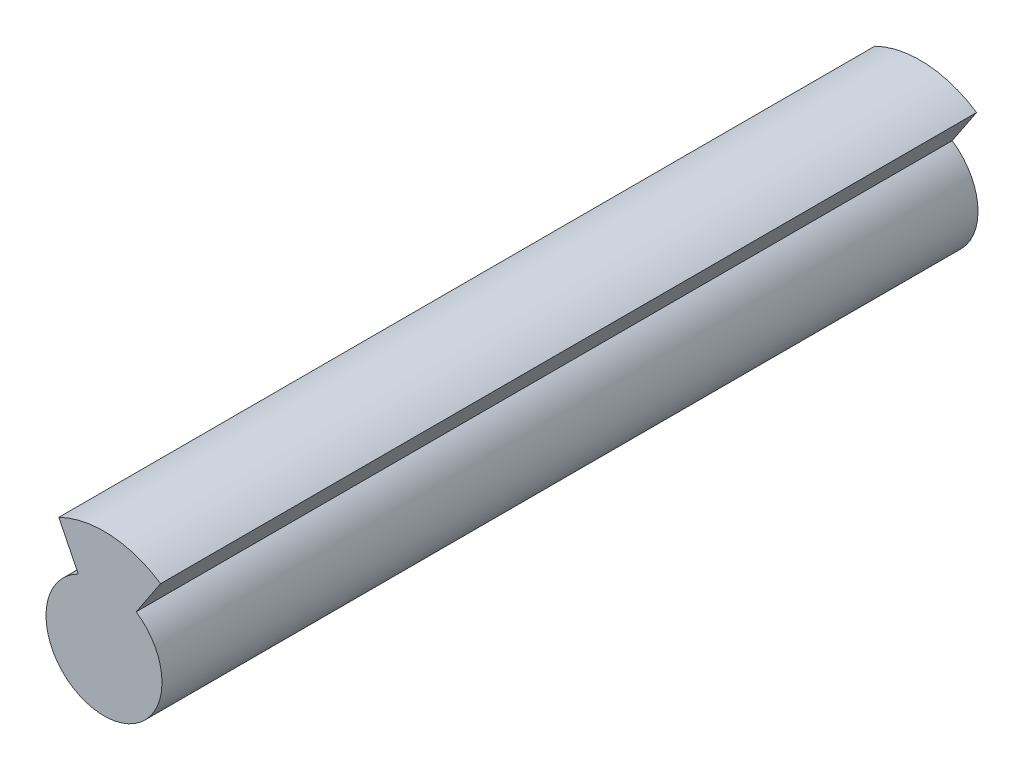
from build123d import *

# Parameters (mm, degrees)
SKETCH1_R           = 8.53
BOSS_EXTRUDE1_DEPTH = 120


with BuildPart() as part:
    # Sketch1 → Boss-Extrude1 (new body)
    with BuildSketch(Plane.XY):
        Circle(SKETCH1_R)
        with BuildLine():
            ThreePointArc((-6.646674341, 13.446996699), (0.96730952, 14.968777916), (8.322103575, 12.479687179))
            Line((8.322103575, 12.479687179), (0, 0))
            Line((0, 0), (-6.646674341, 13.446996699))
        make_face()
        with BuildLine():
            ThreePointArc((4.7325029, 7.096782109), (0.55007668, 8.512245041), (-3.779742142, 7.646858789))
            Line((-3.779742142, 7.646858789), (0, 0))
            Line((0, 0), (4.7325029, 7.096782109))
        make_face()
        with BuildLine():
            Line((0, 0), (-3.779742142, 7.646858789))
            ThreePointArc((-3.779742142, 7.646858789), (-4.501094285, -7.245760846), (8.53, 0))
            ThreePointArc((8.53, 0), (7.520942419, 4.024465819), (4.7325029, 7.096782109))
            Line((4.7325029, 7.096782109), (0, 0))
        make_face()
    extrude(amount=BOSS_EXTRUDE1_DEPTH)


solid = part.part
